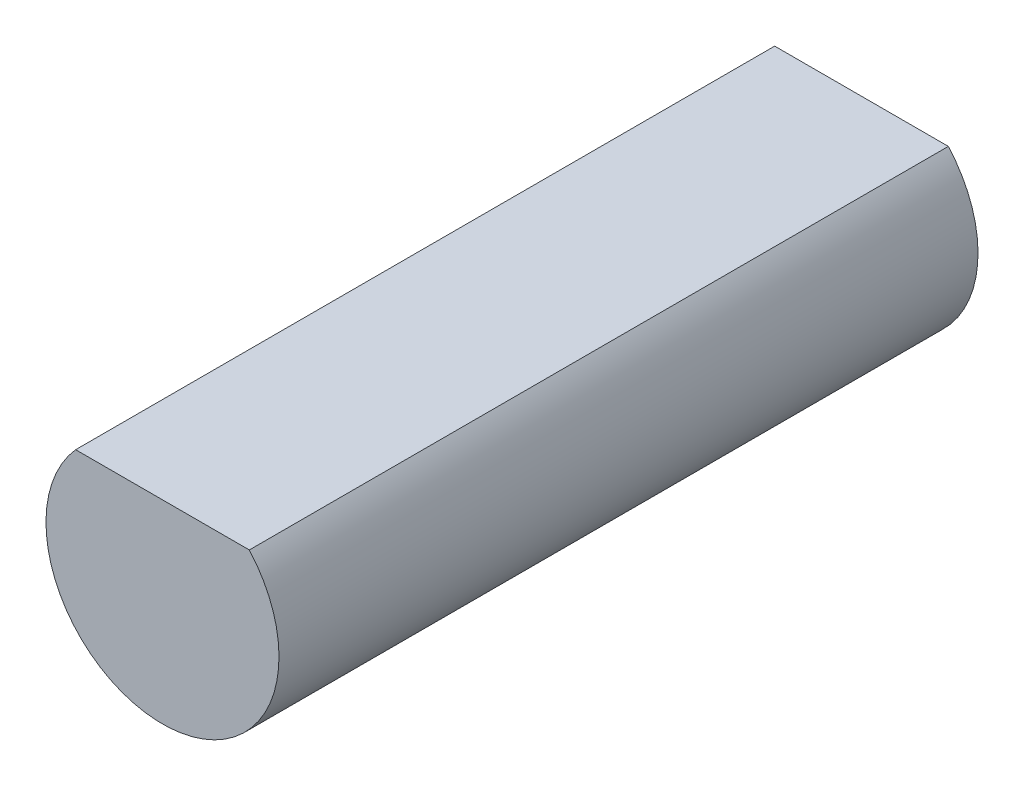
from build123d import *

# Parameters (mm, degrees)
BOSS_EXTRUDE1_DEPTH = 9


with BuildPart() as part:
    # Sketch1 → Boss-Extrude1 (new body)
    with BuildSketch(Plane.XY):
        with BuildLine():
            Line((-1.118033989, 1), (1.118033989, 1))
            ThreePointArc((1.118033989, 1), (0, -1.5), (-1.118033989, 1))
        make_face()
    extrude(amount=BOSS_EXTRUDE1_DEPTH)


solid = part.part
